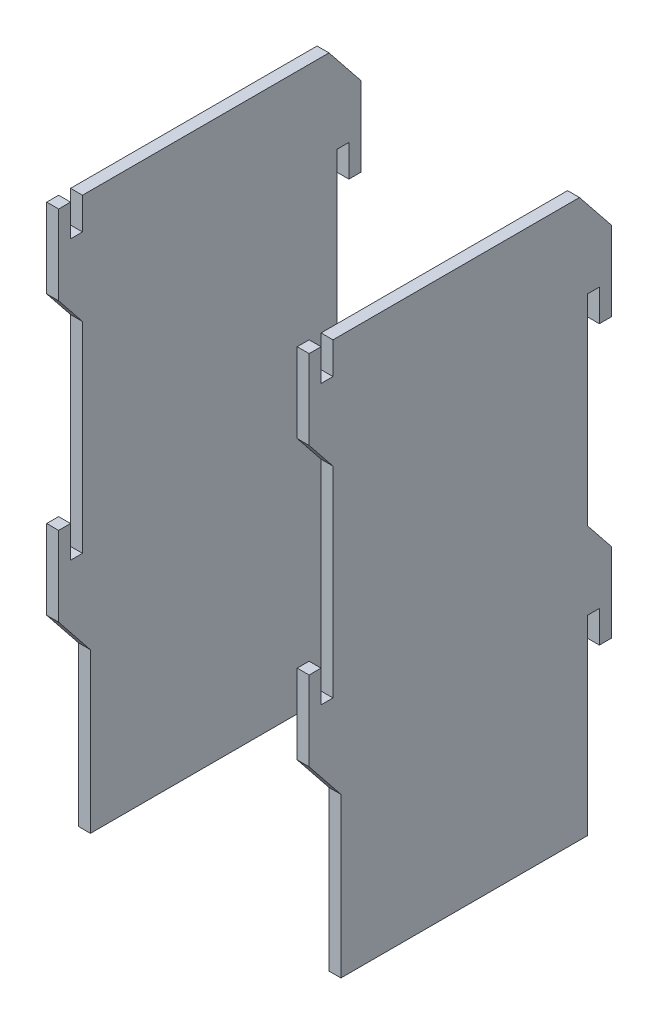
from build123d import *

# Parameters (mm, degrees)
EXTRUDE_1_DEPTH          = 66
CUT_EXTRUDE_1_DEPTH      = 170.870538941
CUT_EXTRUDE_1_DEPTH_BACK = 170.870538941
SKETCH_3_W               = 60
SKETCH_3_H               = 140


with BuildPart() as part:
    # 草图2 → 凸台-拉伸1 (new body)
    with BuildSketch(Plane(origin=(0, 0, 0), x_dir=(0, 0, -1), z_dir=(1, 0, 0))):
        Polygon((0, 140), (-2, 140), (-2, 132), (-5, 132), (-5, 140), (-8, 140), (-8, 120), (-2, 112.5), (-2, 70), (-2, 62), (-5, 62), (-5, 70), (-8, 70), (-8, 50), (0, 40), (0, 0), (60, 0), (62, 0), (62, 40), (62, 48), (65, 48), (65, 40), (68, 40), (68, 60), (62, 67.5), (62, 110), (62, 118), (65, 118), (65, 110), (68, 110), (68, 130), (60, 140), align=None)
    extrude(amount=EXTRUDE_1_DEPTH)

    # 草图3 → 切除-拉伸1 (cut, two sides: drawn at the far end of the back side and taken through both)
    with BuildSketch(Plane(origin=(0, 0, -62), x_dir=(-1, 0, 0), z_dir=(0, 0, -1)).offset(-CUT_EXTRUDE_1_DEPTH_BACK)):
        with Locations((-33, 70)):
            Rectangle(SKETCH_3_W, SKETCH_3_H)
    extrude(amount=CUT_EXTRUDE_1_DEPTH + CUT_EXTRUDE_1_DEPTH_BACK, mode=Mode.SUBTRACT)


with BuildPart() as cut_extrude_1_piece_1:
    # of the separate pieces the step leaves, piece 1, a body of its own (cut_extrude_1_pieces)
    add(part.part.solids().sort_by_distance((63, 140, 2))[0])


with BuildPart() as cut_extrude_1_piece_2:
    # of the separate pieces the step leaves, piece 2, a body of its own (cut_extrude_1_pieces)
    add(part.part.solids().sort_by_distance((0, 140, 2))[0])


solid = Compound([cut_extrude_1_piece_1.part, cut_extrude_1_piece_2.part])
